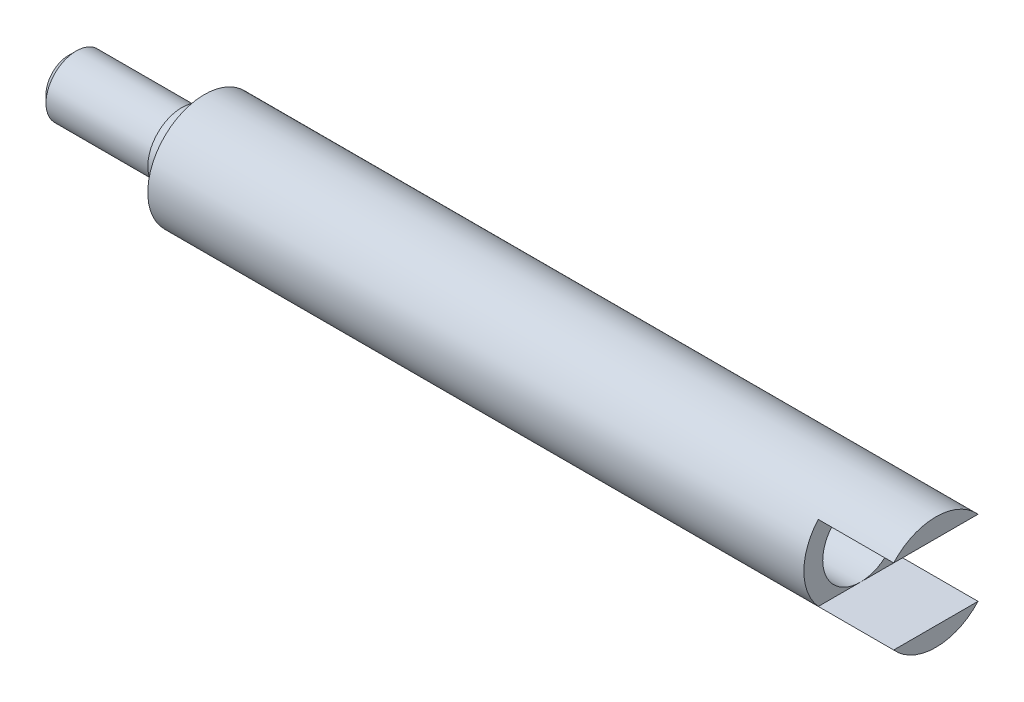
from build123d import *

# Parameters (mm, degrees)
CHAMFER_1_SIZE = 2
SKETCH1_W      = 30
SKETCH1_H      = 20
EXTRUDE1_DEPTH = 20
SKETCH2_R      = 10
EXTRUDE3_DEPTH = 160


with BuildPart() as part:
    # Эскиз1 → Повернуть1 (revolve)
    with BuildSketch(Plane.XY, mode=Mode.PRIVATE) as revolve_1_sk:
        Polygon((0, 0), (0, 8), (30, 8), (30, 9), (36, 9), (36, 15), (230, 15), (230, 0), align=None)
    revolve(revolve_1_sk.sketch.rotate(Axis((0, 0, 0), (-1, 0, 0)), 90), axis=Axis((0, 0, 0), (-1, 0, 0)))

    # Фаска1
    chamfer_1_edges = [part.edges().sort_by_distance(p)[0] for p in [
        (0, 0, 8),
    ]]
    chamfer(chamfer_1_edges, length=CHAMFER_1_SIZE)

    # Sketch1 → Extrude1 (cut)
    with BuildSketch(Plane(origin=(230, 0, 0), x_dir=(0, 0, -1), z_dir=(1, 0, 0))):
        Rectangle(SKETCH1_W, SKETCH1_H)
    extrude(amount=-EXTRUDE1_DEPTH, mode=Mode.SUBTRACT)

    # Sketch2 → Extrude3 (cut)
    with BuildSketch(Plane(origin=(210, 0, 0), x_dir=(0, 0, -1), z_dir=(1, 0, 0))):
        Circle(SKETCH2_R)
    extrude(amount=-EXTRUDE3_DEPTH, mode=Mode.SUBTRACT)


solid = part.part
